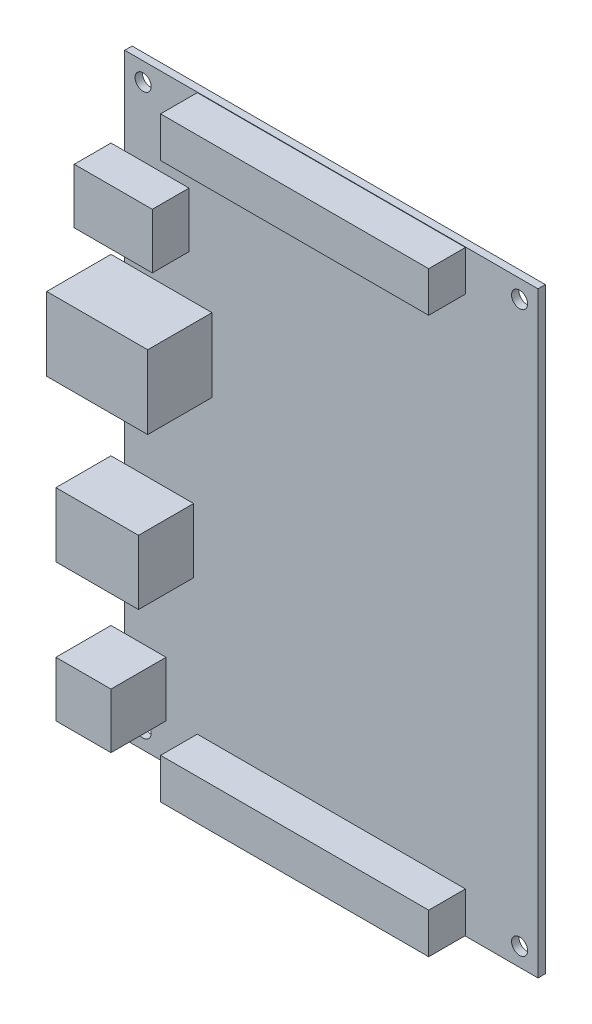
from build123d import *

# Parameters (mm, degrees)
AX_PCB_FLAT_FRONT_COMPARTMENT_START        = 25
SKETCH_1_W                                 = 90
SKETCH_1_H                                 = 130
SKETCH_1_R                                 = 1.75
AX_PCB_FLAT_FRONT_COMPARTMENT_DEPTH        = 1.6
J10_FRONT_CAMERA_HEADER_START              = 26.6
SKETCH_2_W                                 = 58.4
SKETCH_2_H                                 = 8.8
J10_FRONT_CAMERA_HEADER_DEPTH              = 8
J11_REAR_IDC40_START                       = 26.6
SKETCH_3_W                                 = 58.4
SKETCH_3_H                                 = 8.8
J11_REAR_IDC40_DEPTH                       = 8
HDMI_LEFT_START                            = 26.6
SKETCH_5_W                                 = 17
SKETCH_5_H                                 = 12
HDMI_LEFT_DEPTH                            = 8
USB_HOST_LEFT_START                        = 26.6
SKETCH_6_W                                 = 18
SKETCH_6_H                                 = 14
USB_HOST_LEFT_DEPTH                        = 12
RJ45_LEFT_START                            = 26.6
SKETCH_7_W                                 = 22
SKETCH_7_H                                 = 16
RJ45_LEFT_DEPTH                            = 14
DC5521_APPROX_BODY_CLEAR_CAMERA_EDGE_START = 26.6
SKETCH_8_W                                 = 12
SKETCH_8_H                                 = 12
DC5521_APPROX_BODY_CLEAR_CAMERA_EDGE_DEPTH = 12


with BuildPart() as part:
    # 草图1 → AX_PCB_flat_front_compartment (new body)
    with BuildSketch(Plane.XY.offset(AX_PCB_FLAT_FRONT_COMPARTMENT_START)):
        with Locations((0, -77)):
            Rectangle(SKETCH_1_W, SKETCH_1_H)
        with Locations((-41, -138)):
            Circle(SKETCH_1_R, mode=Mode.SUBTRACT)
        with Locations((41, -138)):
            Circle(SKETCH_1_R, mode=Mode.SUBTRACT)
        with Locations((41, -16)):
            Circle(SKETCH_1_R, mode=Mode.SUBTRACT)
        with Locations((-41, -16)):
            Circle(SKETCH_1_R, mode=Mode.SUBTRACT)
    extrude(amount=AX_PCB_FLAT_FRONT_COMPARTMENT_DEPTH)

    # 草图2 → J10_front_camera_header (add)
    with BuildSketch(Plane.XY.offset(J10_FRONT_CAMERA_HEADER_START)):
        with Locations((0, -137.5)):
            Rectangle(SKETCH_2_W, SKETCH_2_H)
    extrude(amount=J10_FRONT_CAMERA_HEADER_DEPTH)

    # 草图3 → J11_rear_IDC40 (add)
    with BuildSketch(Plane.XY.offset(J11_REAR_IDC40_START)):
        with Locations((0, -16.5)):
            Rectangle(SKETCH_3_W, SKETCH_3_H)
    extrude(amount=J11_REAR_IDC40_DEPTH)

    # 草图5 → HDMI_left (add)
    with BuildSketch(Plane.XY.offset(HDMI_LEFT_START)):
        with Locations((-39.5, -37)):
            Rectangle(SKETCH_5_W, SKETCH_5_H)
    extrude(amount=HDMI_LEFT_DEPTH)

    # 草图6 → USB_HOST_left (add)
    with BuildSketch(Plane.XY.offset(USB_HOST_LEFT_START)):
        with Locations((-39, -97)):
            Rectangle(SKETCH_6_W, SKETCH_6_H)
    extrude(amount=USB_HOST_LEFT_DEPTH)

    # 草图7 → RJ45_left (add)
    with BuildSketch(Plane.XY.offset(RJ45_LEFT_START)):
        with Locations((-37, -60)):
            Rectangle(SKETCH_7_W, SKETCH_7_H)
    extrude(amount=RJ45_LEFT_DEPTH)

    # 草图8 → DC5521_approx_body_clear_camera_edge (add)
    with BuildSketch(Plane.XY.offset(DC5521_APPROX_BODY_CLEAR_CAMERA_EDGE_START)):
        with Locations((-42, -128)):
            Rectangle(SKETCH_8_W, SKETCH_8_H)
    extrude(amount=DC5521_APPROX_BODY_CLEAR_CAMERA_EDGE_DEPTH)


solid = part.part
